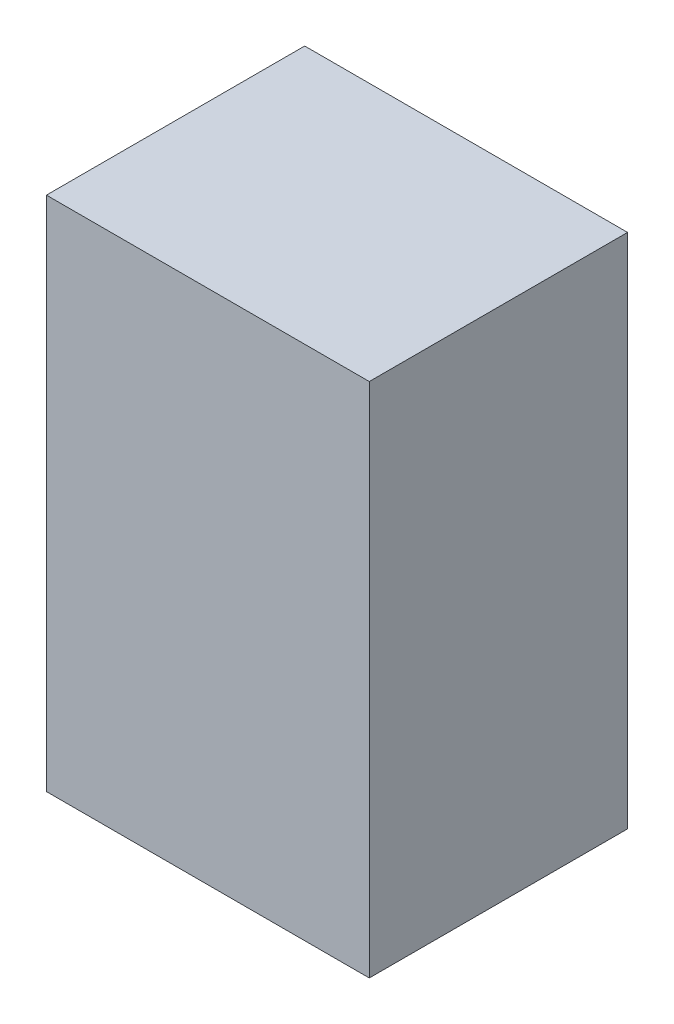
from build123d import *

# Parameters (mm, degrees)
SKETCH1_W           = 0.25
SKETCH1_H           = 0.4
BOSS_EXTRUDE1_DEPTH = 0.2


with BuildPart() as part:
    # Sketch1 → Boss-Extrude1 (new body)
    with BuildSketch(Plane.XY):
        with Locations((0.125, 0.2)):
            Rectangle(SKETCH1_W, SKETCH1_H)
    extrude(amount=BOSS_EXTRUDE1_DEPTH)


solid = part.part
